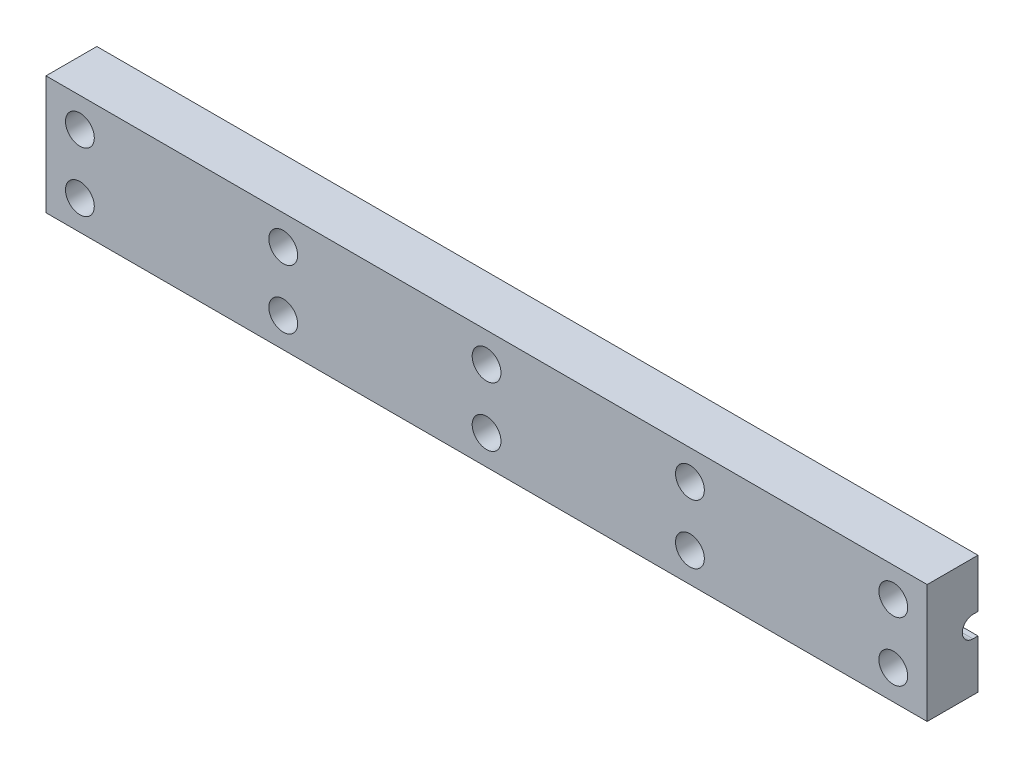
from build123d import *

# Parameters (mm, degrees)
BOSS_EXTRUDE1_DEPTH      = 60
BOSS_EXTRUDE1_DEPTH_BACK = 20
SKETCH2_R                = 1.7
CUT_EXTRUDE1_DEPTH       = 10
BOSS_EXTRUDE2_START      = 24
BOSS_EXTRUDE2_DEPTH      = 24
SKETCH4_R                = 1.7
CUT_EXTRUDE2_DEPTH       = 24


with BuildPart() as part:
    # Sketch1 → Boss-Extrude1 (new, two sides: drawn at the far end of the back side and taken through both)
    with BuildSketch(Plane(origin=(190.645148, 0, 0), x_dir=(0, 0, -1), z_dir=(1, 0, 0)).offset(-BOSS_EXTRUDE1_DEPTH_BACK)):
        with BuildLine():
            Line((-246.970904961, 208.163538159), (-246.970904961, 205.163538159))
            Line((-246.970904961, 205.163538159), (-246.970904961, 197.163538159))
            Line((-246.970904961, 197.163538159), (-246.970904961, 194.163538159))
            Line((-246.970904961, 194.163538159), (-240.970904961, 194.163538159))
            Line((-240.970904961, 194.163538159), (-240.970904961, 197.163538159))
            Line((-240.970904961, 197.163538159), (-240.970904961, 199.913538158))
            Line((-240.970904961, 199.913538158), (-241.570904961, 199.913538158))
            ThreePointArc((-241.570904961, 199.913538158), (-242.820904961, 201.163538162), (-241.570904955, 202.413538158))
            Line((-241.570904955, 202.413538158), (-240.970904961, 202.413538158))
            Line((-240.970904961, 202.413538158), (-240.970904961, 205.163538159))
            Line((-240.970904961, 205.163538159), (-240.970904961, 208.163538159))
            Line((-240.970904961, 208.163538159), (-246.970904961, 208.163538159))
        make_face()
    extrude(amount=BOSS_EXTRUDE1_DEPTH + BOSS_EXTRUDE1_DEPTH_BACK)

    # Sketch2 → Cut-Extrude1 (cut)
    with BuildSketch(Plane.XY.offset(246.970904961)):
        with Locations((246.645148, 197.663538159)):
            Circle(SKETCH2_R)
        with Locations((198.645148, 197.663538159)):
            Circle(SKETCH2_R)
        with Locations((174.645148, 197.663538159)):
            Circle(SKETCH2_R)
        with Locations((222.645148, 197.663538159)):
            Circle(SKETCH2_R)
        with Locations((174.645148, 204.663538159)):
            Circle(SKETCH2_R)
        with Locations((198.645148, 204.663538159)):
            Circle(SKETCH2_R)
        with Locations((222.645148, 204.663538159)):
            Circle(SKETCH2_R)
        with Locations((246.645148, 204.663538159)):
            Circle(SKETCH2_R)
    extrude(amount=-CUT_EXTRUDE1_DEPTH, mode=Mode.SUBTRACT)

    # Sketch3 → Boss-Extrude2 (add)
    with BuildSketch(Plane.ZY.offset(-170.645148).offset(BOSS_EXTRUDE2_START)):
        with BuildLine():
            Line((246.970904961, 208.163538159), (240.970904961, 208.163538159))
            Line((240.970904961, 208.163538159), (240.970904961, 202.413538158))
            Line((240.970904961, 202.413538158), (241.570904955, 202.413538158))
            ThreePointArc((241.570904955, 202.413538158), (242.820904961, 201.163538162), (241.570904961, 199.913538158))
            Line((241.570904961, 199.913538158), (240.970904961, 199.913538158))
            Line((240.970904961, 199.913538158), (240.970904961, 194.163538159))
            Line((240.970904961, 194.163538159), (246.970904961, 194.163538159))
            Line((246.970904961, 194.163538159), (246.970904961, 208.163538159))
        make_face()
    extrude(amount=-BOSS_EXTRUDE2_DEPTH)

    # Sketch4 → Cut-Extrude2 (cut)
    with BuildSketch(Plane.XY.offset(246.970904961)):
        with Locations((150.645148, 197.663538159)):
            Circle(SKETCH4_R)
        with Locations((150.645148, 204.663538159)):
            Circle(SKETCH4_R)
    extrude(amount=-CUT_EXTRUDE2_DEPTH, mode=Mode.SUBTRACT)


solid = part.part
